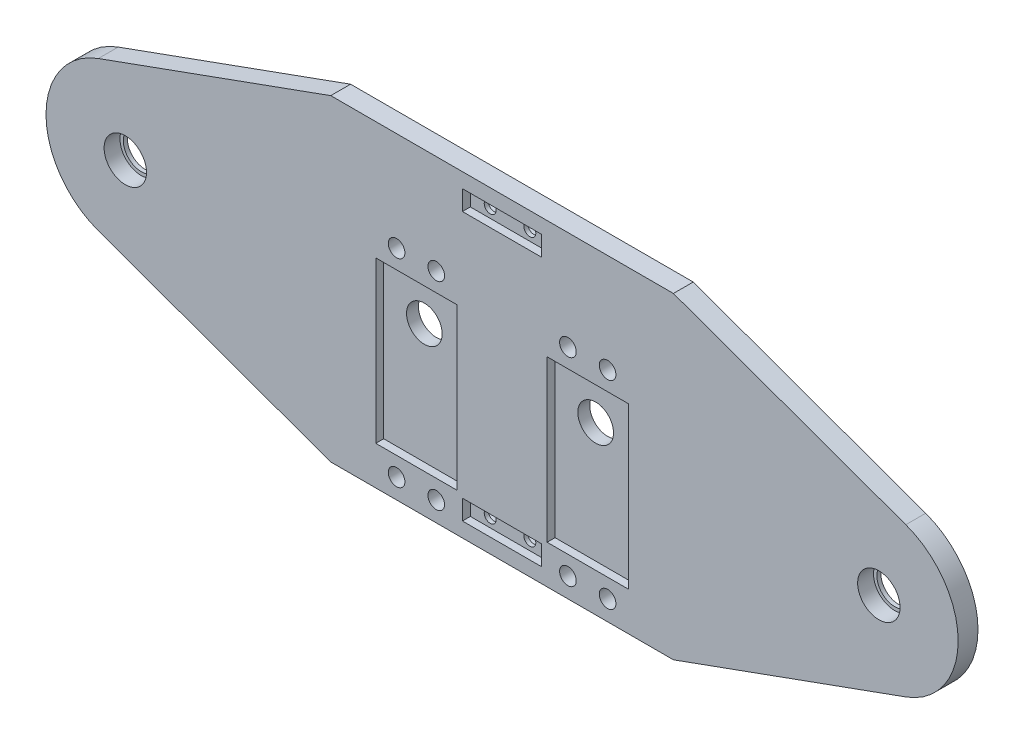
from build123d import *

# Parameters (mm, degrees)
SKETCH_1_R           = 4.5
EXTRUDE_4_DEPTH      = 5
SKETCH_3_R           = 5.35
CUT_EXTRUDE_3_DEPTH  = 4
SKETCH_11_R          = 1.5
CUT_EXTRUDE_13_DEPTH = 214.834047803
SKETCH_12_W          = 20
SKETCH_12_H          = 5
CUT_EXTRUDE_14_DEPTH = 2
SKETCH_13_W          = 20
SKETCH_13_H          = 5
CUT_EXTRUDE_15_DEPTH = 2
SKETCH_14_R          = 2.1
CUT_EXTRUDE_17_DEPTH = 214.834047803
SKETCH_15_W          = 20.5
SKETCH_15_H          = 40.5
CUT_EXTRUDE_18_DEPTH = 2


with BuildPart() as part:
    # 草图1 → 凸台-拉伸4 (new body)
    with BuildSketch(Plane.XY):
        with BuildLine():
            ThreePointArc((-6.801514389, 18.807961134), (-20, 0), (-6.801514389, -18.807961134))
            Line((-6.801514389, -18.807961134), (51.8, -40))
            Line((51.8, -40), (138.2, -40))
            Line((138.2, -40), (196.801514389, -18.807961134))
            ThreePointArc((196.801514389, -18.807961134), (210, 0), (196.801514389, 18.807961134))
            Line((196.801514389, 18.807961134), (138.2, 40))
            Line((138.2, 40), (51.8, 40))
            Line((51.8, 40), (-6.801514389, 18.807961134))
        make_face()
        with Locations((73.4, 0)):
            Circle(SKETCH_1_R, mode=Mode.SUBTRACT)
        Circle(SKETCH_1_R, mode=Mode.SUBTRACT)
        with Locations((116.6, 0)):
            Circle(SKETCH_1_R, mode=Mode.SUBTRACT)
        with Locations((190, 0)):
            Circle(SKETCH_1_R, mode=Mode.SUBTRACT)
    extrude(amount=EXTRUDE_4_DEPTH)

    # 草图3 → 切除-拉伸3 (cut)
    with BuildSketch(Plane.XY.offset(5)):
        Circle(SKETCH_3_R)
        with Locations((190, 0)):
            Circle(SKETCH_3_R)
    extrude(amount=-CUT_EXTRUDE_3_DEPTH, mode=Mode.SUBTRACT)

    # 草图11 → 切除-拉伸13 (cut, through all)
    with BuildSketch(Plane.XY.offset(5)):
        with Locations((100, 33.790093942)):
            Circle(SKETCH_11_R)
        with Locations(Location((90, 33.790093942, 0), (0, 0, 180))):
            Circle(SKETCH_11_R)
        with Locations(Location((100, -33.790093942, 0), (0, 0, 180))):
            Circle(SKETCH_11_R)
        with Locations((90, -33.790093942)):
            Circle(SKETCH_11_R)
    extrude(amount=-CUT_EXTRUDE_13_DEPTH, mode=Mode.SUBTRACT)

    # 草图12 → 切除-拉伸14 (cut)
    with BuildSketch(Plane.XY.offset(5)):
        with Locations((95, 33.790093942)):
            Rectangle(SKETCH_12_W, SKETCH_12_H)
        with Locations((95, -33.790093942)):
            Rectangle(SKETCH_12_W, SKETCH_12_H)
    extrude(amount=-CUT_EXTRUDE_14_DEPTH, mode=Mode.SUBTRACT)

    # 草图13 → 切除-拉伸15 (cut)
    with BuildSketch(Plane(origin=(0, 0, 0), x_dir=(-1, 0, 0), z_dir=(0, 0, -1))):
        with Locations((-95, 33.790093942)):
            Rectangle(SKETCH_13_W, SKETCH_13_H)
        with Locations((-95, -33.790093942)):
            Rectangle(SKETCH_13_W, SKETCH_13_H)
    extrude(amount=-CUT_EXTRUDE_15_DEPTH, mode=Mode.SUBTRACT)

    # 草图14 → 切除-拉伸17 (cut, through all)
    with BuildSketch(Plane.XY.offset(5)):
        with Locations((78.4, -35)):
            Circle(SKETCH_14_R)
        with Locations((78.4, 15)):
            Circle(SKETCH_14_R)
        with Locations(Location((68.4, -35, 0), (0, 0, 180))):
            Circle(SKETCH_14_R)
        with Locations((111.6, -35)):
            Circle(SKETCH_14_R)
        with Locations((121.6, -35)):
            Circle(SKETCH_14_R)
        with Locations(Location((68.4, 15, 0), (0, 0, 180))):
            Circle(SKETCH_14_R)
        with Locations((111.6, 15)):
            Circle(SKETCH_14_R)
        with Locations((121.6, 15)):
            Circle(SKETCH_14_R)
    extrude(amount=-CUT_EXTRUDE_17_DEPTH, mode=Mode.SUBTRACT)

    # 草图15 → 切除-拉伸18 (cut)
    with BuildSketch(Plane.XY.offset(5)):
        with Locations((73.4, -10)):
            Rectangle(SKETCH_15_W, SKETCH_15_H)
        with Locations((116.6, -10)):
            Rectangle(SKETCH_15_W, SKETCH_15_H)
    extrude(amount=-CUT_EXTRUDE_18_DEPTH, mode=Mode.SUBTRACT)


solid = part.part
